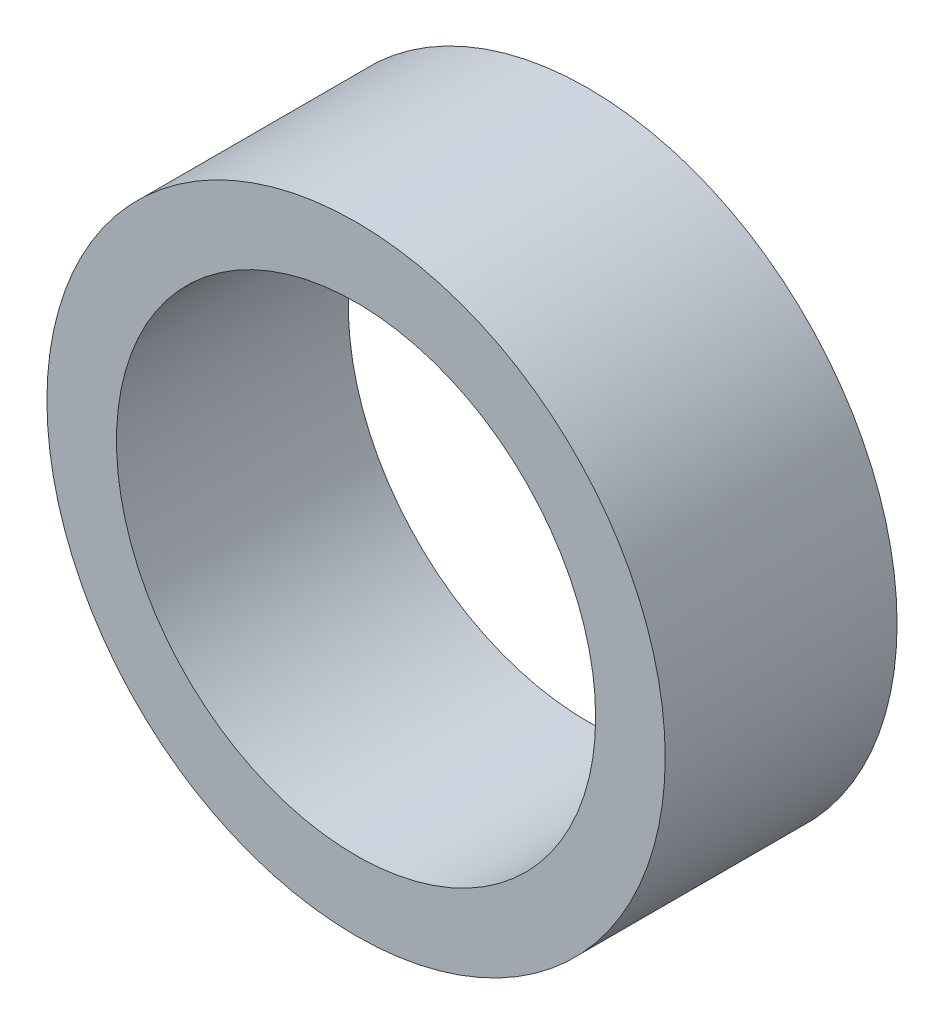
from build123d import *

# Parameters (mm, degrees)
SKETCH1_R           = 4
SKETCH1_R_2         = 3.1
BOSS_EXTRUDE1_DEPTH = 3


with BuildPart() as part:
    # Sketch1 → Boss-Extrude1 (new body)
    with BuildSketch(Plane.XY):
        Circle(SKETCH1_R)
        Circle(SKETCH1_R_2, mode=Mode.SUBTRACT)
    extrude(amount=BOSS_EXTRUDE1_DEPTH)


solid = part.part
